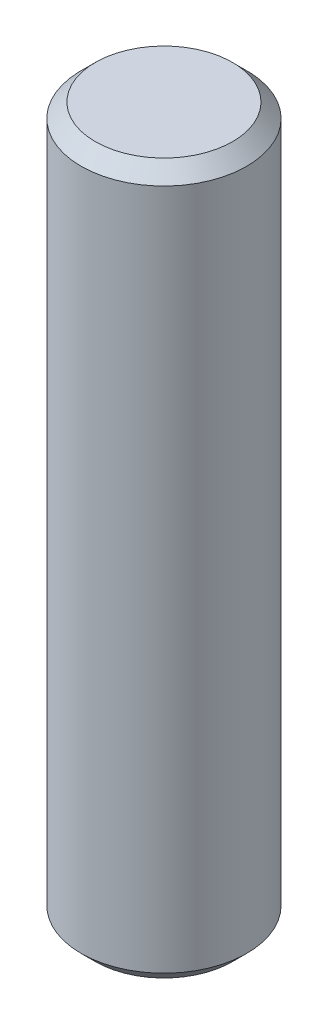
from build123d import *

# Parameters (mm, degrees)
SKETCH1_R           = 1.75
BOSS_EXTRUDE1_DEPTH = 15
CHAMFER1_SIZE       = 0.3


with BuildPart() as part:
    # Sketch1 → Boss-Extrude1 (new body)
    with BuildSketch(Plane(origin=(0, 0, 0), x_dir=(1, 0, 0), z_dir=(0, 1, 0))):
        with Locations(Location((0, 0, 0), (0, 0, 270))):
            Circle(SKETCH1_R)
    extrude(amount=-BOSS_EXTRUDE1_DEPTH)

    # Chamfer1
    chamfer1_edges = [part.edges().sort_by_distance(p)[0] for p in [
        (0, 0, -1.75),
        (0, -15, -1.75),
    ]]
    chamfer(chamfer1_edges, length=CHAMFER1_SIZE)


solid = part.part
